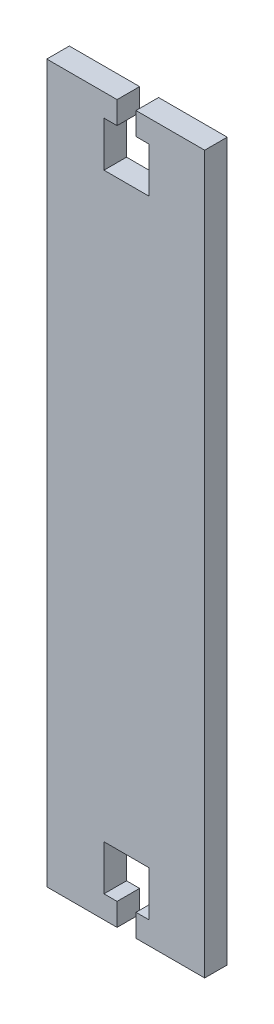
from build123d import *

# Parameters (mm, degrees)
BOSS_EXTRU_2_DEPTH = 5


with BuildPart() as part:
    # Esquisse1 → Boss.-Extru.2 (new body)
    with BuildSketch(Plane.XY):
        Polygon((0, 0), (15.58, 0), (15.58, 5), (12.68, 5), (12.68, 15), (22.68, 15), (22.68, 5), (19.78, 5), (19.78, 0), (35, 0), (35, 158.92), (19.78, 158.92), (19.78, 153.92), (22.68, 153.92), (22.68, 143.92), (12.68, 143.92), (12.68, 153.92), (15.58, 153.92), (15.58, 158.92), (0, 158.92), align=None)
    extrude(amount=BOSS_EXTRU_2_DEPTH)


solid = part.part
